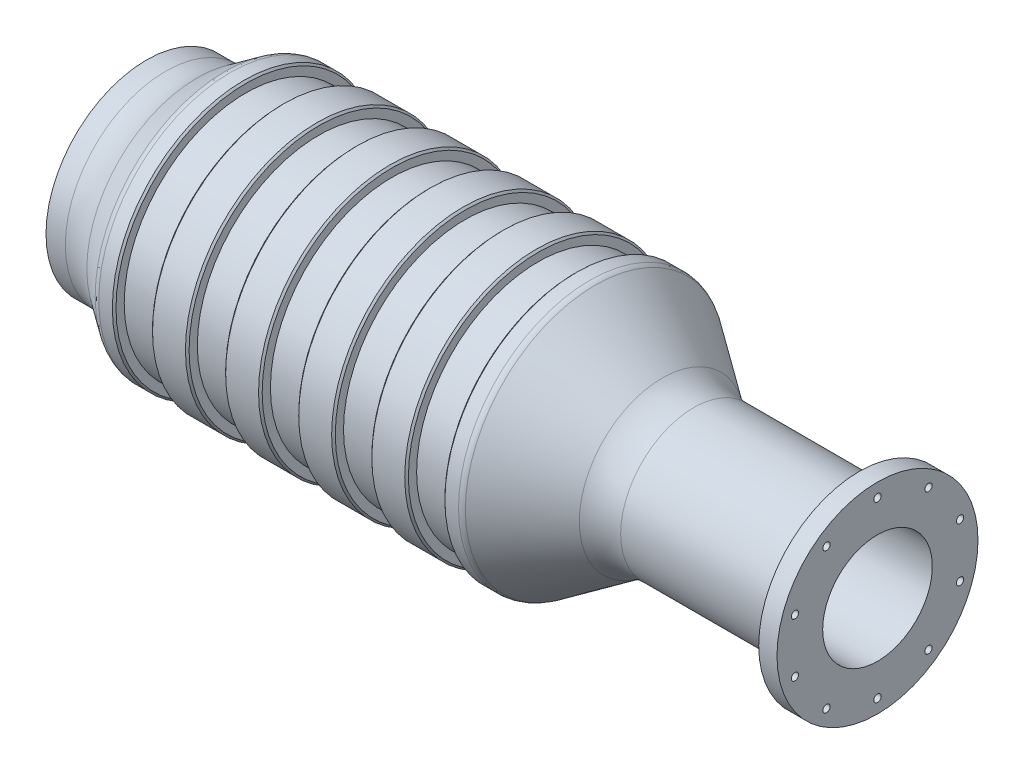
from build123d import *

# Parameters (mm, degrees)
FILLET1_R          = 30
CHAMFER1_SIZE      = 1
FILLET2_R          = 5
SKETCH2_R          = 2
CUT_EXTRUDE1_DEPTH = 10
SKETCH3_R          = 2
CUT_EXTRUDE2_DEPTH = 10
CIRPATTERN1_COUNT  = 10


with BuildPart() as part:
    # Sketch1 → Revolve1 (revolve)
    with BuildSketch(Plane.XY, mode=Mode.PRIVATE) as revolve1_sk:
        with BuildLine():
            Line((200, 30), (93.152987889, 30))
            ThreePointArc((93.152987889, 30), (87.138871899, 30.925660985), (81.681459162, 33.616959114))
            Line((81.681459162, 33.616959114), (44.883680838, 59.383040886))
            ThreePointArc((44.883680838, 59.383040886), (39.426268101, 62.074339015), (33.412152111, 63))
            Line((33.412152111, 63), (-144.813624543, 63))
            ThreePointArc((-144.813624543, 63), (-150.827740533, 62.074339015), (-156.28515327, 59.383040886))
            Line((-156.28515327, 59.383040886), (-171.660711492, 48.616959114))
            ThreePointArc((-171.660711492, 48.616959114), (-177.118124229, 45.925660985), (-183.132240219, 45))
            Line((-183.132240219, 45), (-185, 45))
            ThreePointArc((-185, 45), (-188.535533906, 43.535533906), (-190, 40))
            Line((-190, 40), (-190, 25))
            Line((-190, 25), (-200, 25))
            Line((-200, 25), (-200, 55))
            Line((-200, 55), (-179.97925233, 55))
            Line((-179.97925233, 55), (-155.700736216, 72))
            Line((-155.700736216, 72), (-145.700736216, 72))
            Line((-145.700736216, 72), (-145.700736216, 66.5))
            Line((-145.700736216, 66.5), (-125.700736216, 66.5))
            Line((-125.700736216, 66.5), (-125.700736216, 72))
            Line((-125.700736216, 72), (-105.700736216, 72))
            Line((-105.700736216, 72), (-105.700736216, 66.5))
            Line((-105.700736216, 66.5), (-85.700736216, 66.5))
            Line((-85.700736216, 66.5), (-85.700736216, 72))
            Line((-85.700736216, 72), (-65.700736216, 72))
            Line((-65.700736216, 72), (-65.700736216, 66.5))
            Line((-65.700736216, 66.5), (-45.700736216, 66.5))
            Line((-45.700736216, 66.5), (-45.700736216, 72))
            Line((-45.700736216, 72), (-25.700736216, 72))
            Line((-25.700736216, 72), (-25.700736216, 66.5))
            Line((-25.700736216, 66.5), (-5.700736216, 66.5))
            Line((-5.700736216, 66.5), (-5.700736216, 72))
            Line((-5.700736216, 72), (14.299263784, 72))
            Line((14.299263784, 72), (14.299263784, 66.5))
            Line((14.299263784, 66.5), (34.299263784, 66.5))
            Line((34.299263784, 66.5), (34.299263784, 72))
            Line((34.299263784, 72), (44.299263784, 72))
            Line((44.299263784, 72), (90, 40))
            Line((90, 40), (190, 40))
            Line((190, 40), (190, 55))
            Line((190, 55), (200, 55))
            Line((200, 55), (200, 30))
        make_face()
    revolve(revolve1_sk.sketch.rotate(Axis((-41.922861934, 0, 0), (1, 0, 0)), 90), axis=Axis((-41.922861934, 0, 0), (1, 0, 0)))

    # Fillet1
    fillet1_edges = [part.edges().sort_by_distance(p)[0] for p in [
        (90, 0, -40),
        (-179.97925233, 0, -55),
    ]]
    fillet(fillet1_edges, radius=FILLET1_R)

    # Chamfer1
    chamfer1_edges = [part.edges().sort_by_distance(p)[0] for p in [
        (34.299263784, 0, -72),
        (14.299263784, 0, -72),
        (-5.700736216, 0, -72),
        (-25.700736216, 0, -72),
        (-45.700736216, 0, -72),
        (-65.700736216, 0, -72),
        (-85.700736216, 0, -72),
        (-105.700736216, 0, -72),
        (-125.700736216, 0, -72),
        (-145.700736216, 0, -72),
    ]]
    chamfer(chamfer1_edges, length=CHAMFER1_SIZE)

    # Fillet2
    fillet2_edges = [part.edges().sort_by_distance(p)[0] for p in [
        (190, 0, -40),
        (44.299263784, 0, -72),
        (-155.700736216, 0, -72),
    ]]
    fillet(fillet2_edges, radius=FILLET2_R)

    # Sketch2 → Cut-Extrude1 (cut)
    with BuildSketch(Plane.ZY.offset(200)):
        with Locations((0, 45)):
            Circle(SKETCH2_R)
    cut_extrude1 = extrude(amount=-CUT_EXTRUDE1_DEPTH, mode=Mode.SUBTRACT)

    # Sketch3 → Cut-Extrude2 (cut)
    with BuildSketch(Plane(origin=(200, 0, 0), x_dir=(0, 0, -1), z_dir=(1, 0, 0))):
        with Locations((0, 47.5)):
            Circle(SKETCH3_R)
    cut_extrude2 = extrude(amount=-CUT_EXTRUDE2_DEPTH, mode=Mode.SUBTRACT)

    # CirPattern1: Cut-Extrude1, Cut-Extrude2 ×10 about axis
    cirpattern1_axis = Axis((0, 0, 0), (1, 0, 0))
    add([cut_extrude1.rotate(cirpattern1_axis, i * 360 / CIRPATTERN1_COUNT) for i in range(1, CIRPATTERN1_COUNT)], mode=Mode.SUBTRACT)
    add([cut_extrude2.rotate(cirpattern1_axis, i * 360 / CIRPATTERN1_COUNT) for i in range(1, CIRPATTERN1_COUNT)], mode=Mode.SUBTRACT)


solid = part.part
